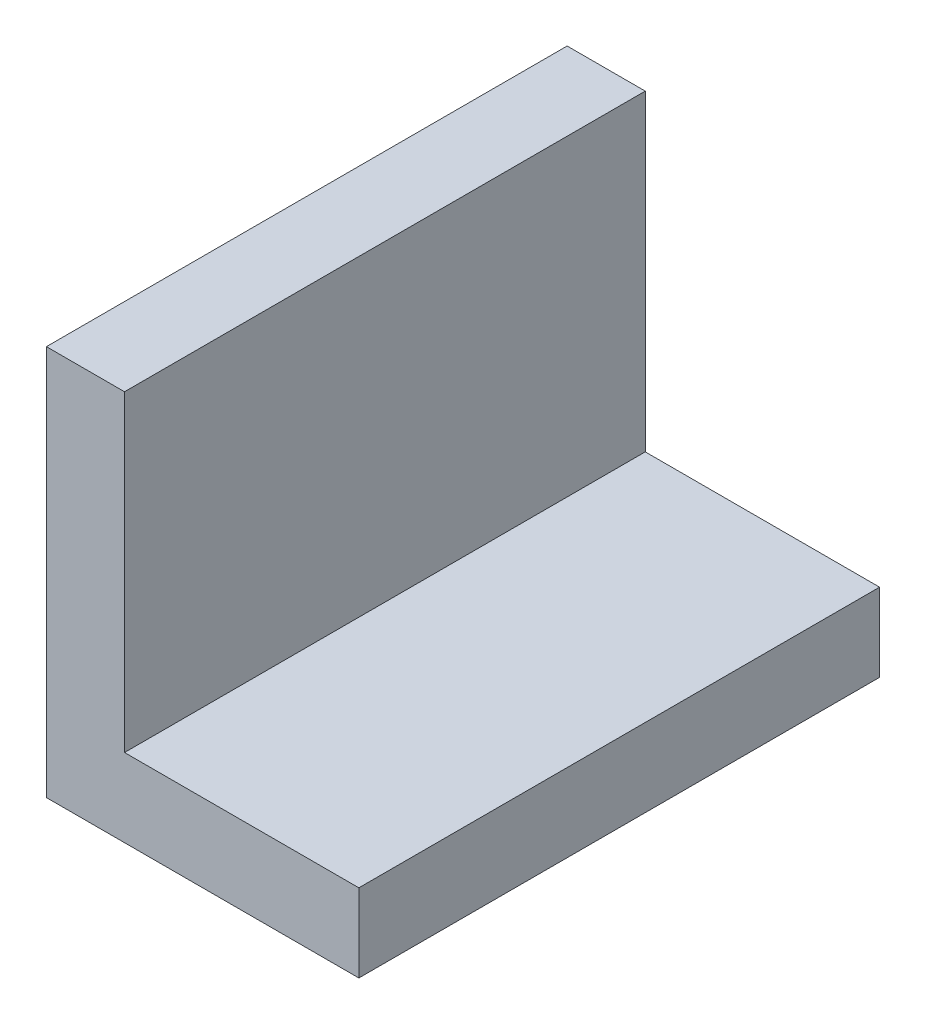
from build123d import *

# Parameters (mm, degrees)
BOSS_EXTRUDE1_DEPTH = 100


with BuildPart() as part:
    # Sketch1 → Boss-Extrude1 (new body)
    with BuildSketch(Plane.XY):
        Polygon((0, 0), (0, 75), (15, 75), (15, 15), (60, 15), (60, 0), align=None)
    extrude(amount=BOSS_EXTRUDE1_DEPTH)


solid = part.part
